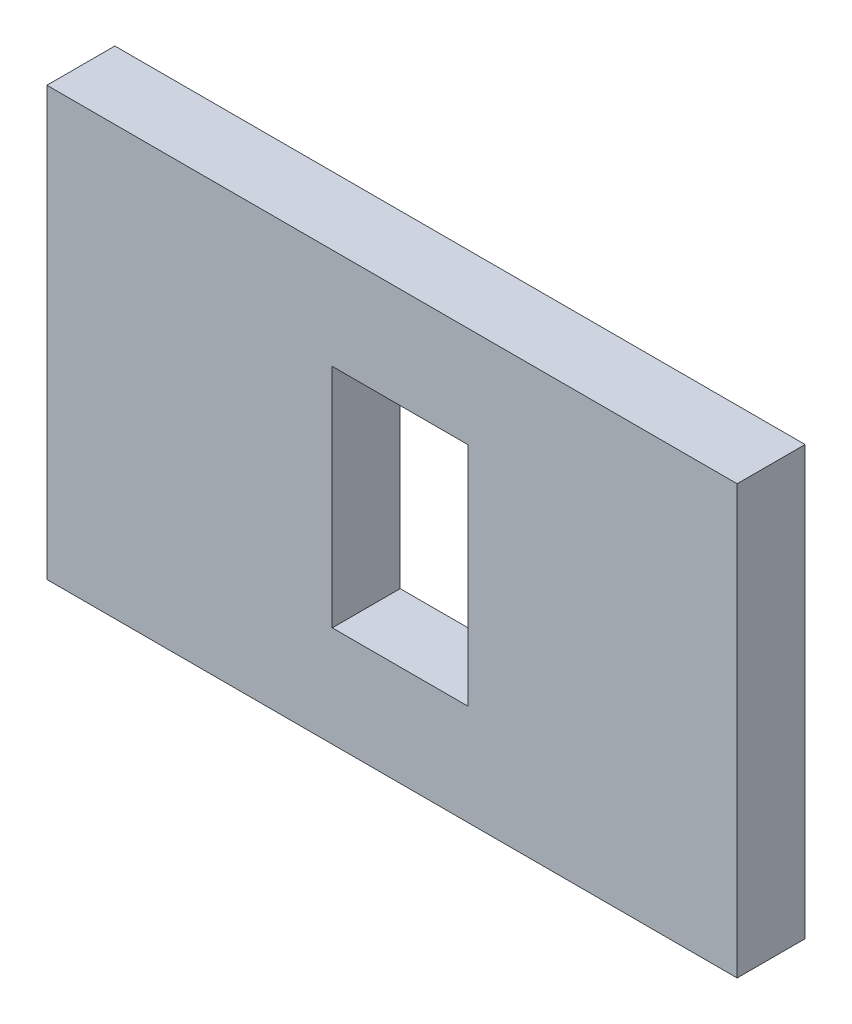
from build123d import *

# Parameters (mm, degrees)
SKETCH1_W           = 60.953511789
SKETCH1_H           = 37.8
SKETCH1_W_2         = 12
SKETCH1_H_2         = 20
BOSS_EXTRUDE1_DEPTH = 6


with BuildPart() as part:
    # Sketch1 → Boss-Extrude1 (new body)
    with BuildSketch(Plane.XY):
        with Locations((94.27914375, 18.9)):
            Rectangle(SKETCH1_W, SKETCH1_H)
        with Locations((95, 18.9)):
            Rectangle(SKETCH1_W_2, SKETCH1_H_2, mode=Mode.SUBTRACT)
    extrude(amount=BOSS_EXTRUDE1_DEPTH)


solid = part.part
